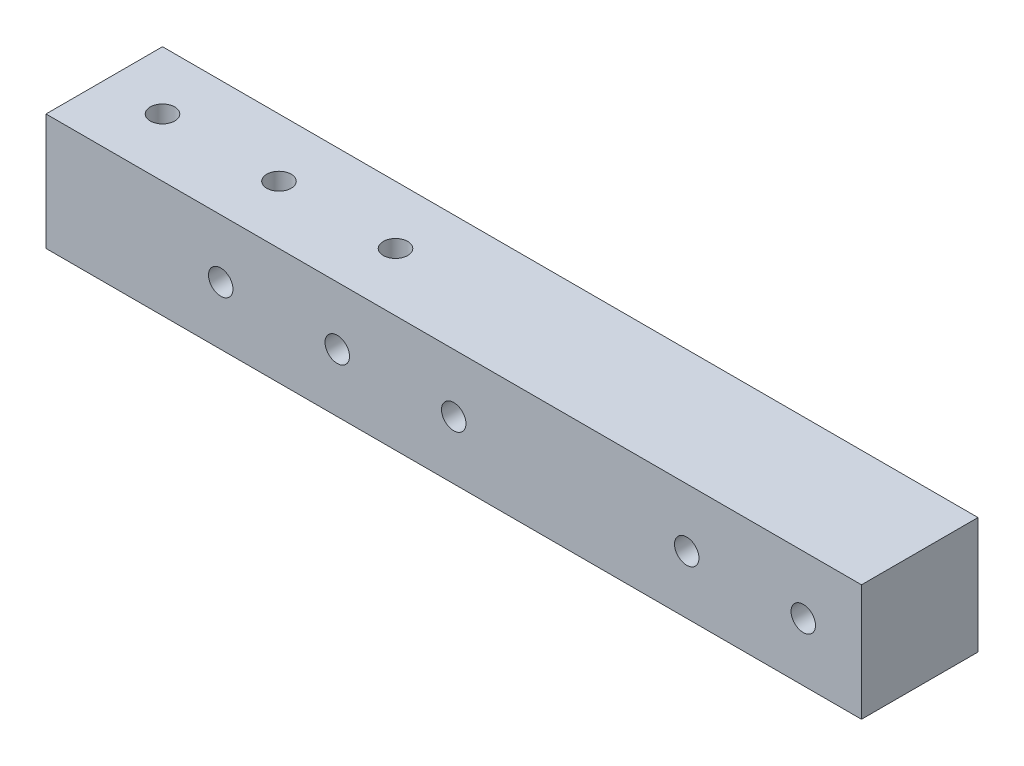
from build123d import *

# Parameters (mm, degrees)
SKETCH_1_W          = 20
SKETCH_1_H          = 20
EXTRUDE_1_DEPTH     = 140
SKETCH_3_R          = 2.1
CUT_EXTRUDE_1_DEPTH = 142.774468788
SKETCH_2_R          = 2.1
CUT_EXTRUDE_2_DEPTH = 142.774468788


with BuildPart() as part:
    # 草图1 → 凸台-拉伸1 (new body)
    with BuildSketch(Plane(origin=(0, 0, 0), x_dir=(0, 0, -1), z_dir=(1, 0, 0))):
        Rectangle(SKETCH_1_W, SKETCH_1_H)
    extrude(amount=EXTRUDE_1_DEPTH)

    # 草图3 → 切除-拉伸1 (cut, through all)
    with BuildSketch(Plane.XY.offset(10)):
        with Locations((30, 0)):
            Circle(SKETCH_3_R)
        with Locations((50, 0)):
            Circle(SKETCH_3_R)
        with Locations((70, 0)):
            Circle(SKETCH_3_R)
        with Locations((130, 0)):
            Circle(SKETCH_3_R)
        with Locations((110, 0)):
            Circle(SKETCH_3_R)
    extrude(amount=-CUT_EXTRUDE_1_DEPTH, mode=Mode.SUBTRACT)

    # 草图2 → 切除-拉伸2 (cut, through all)
    with BuildSketch(Plane(origin=(0, 10, 0), x_dir=(1, 0, 0), z_dir=(0, 1, 0))):
        with Locations(Location((10, 0, 0), (0, 0, 270))):
            Circle(SKETCH_2_R)
        with Locations(Location((30, 0, 0), (0, 0, 270))):
            Circle(SKETCH_2_R)
        with Locations(Location((50, 0, 0), (0, 0, 270))):
            Circle(SKETCH_2_R)
    extrude(amount=-CUT_EXTRUDE_2_DEPTH, mode=Mode.SUBTRACT)


solid = part.part
